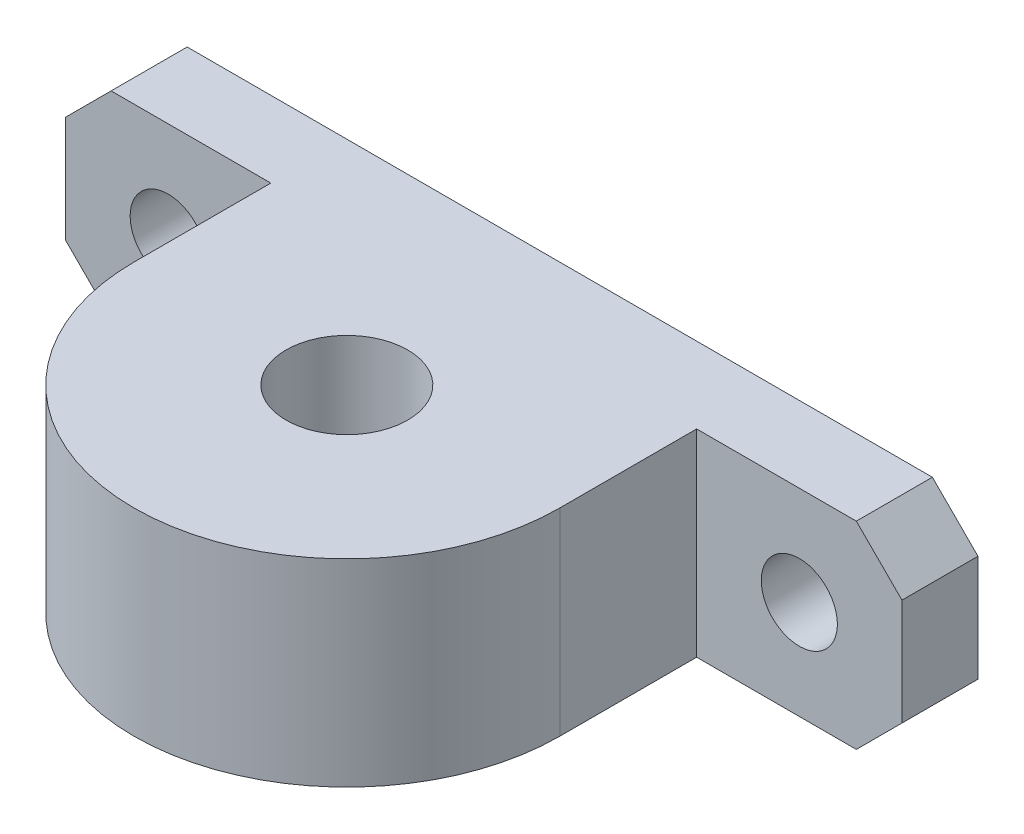
from build123d import *

# Parameters (mm, degrees)
SKETCH_1_R          = 4
EXTRUDE_1_DEPTH     = 13
CUT_EXTRUDE_1_REACH = 43.343
SKETCH_2_R          = 2.5
CHAMFER_1_SIZE      = 3


with BuildPart() as part:
    # 草图1 → 凸台-拉伸1 (new body)
    with BuildSketch(Plane(origin=(0, 0, 0), x_dir=(1, 0, 0), z_dir=(0, 1, 0))):
        with BuildLine():
            Line((-14, 0), (-14, 9))
            Line((-14, 9), (-27.5, 9))
            Line((-27.5, 9), (-27.5, 14))
            Line((-27.5, 14), (-14, 14))
            Line((-14, 14), (14, 14))
            Line((14, 14), (27.5, 14))
            Line((27.5, 14), (27.5, 9))
            Line((27.5, 9), (14, 9))
            Line((14, 9), (14, 0))
            ThreePointArc((14, 0), (9.899494937, -9.899494937), (0, -14))
            ThreePointArc((0, -14), (-9.899494937, -9.899494937), (-14, 0))
        make_face()
        with Locations(Location((0, 0, 0), (0, 0, 90))):
            Circle(SKETCH_1_R, mode=Mode.SUBTRACT)
    extrude(amount=EXTRUDE_1_DEPTH)

    # 草图2 → 切除-拉伸1 (cut, up to next)
    with BuildSketch(Plane(origin=(0, 0, -14), x_dir=(-1, 0, 0), z_dir=(0, 0, -1)), mode=Mode.PRIVATE) as cut_extrude_1_sk1:
        with Locations((-20.75, 6.5)):
            Circle(SKETCH_2_R)
    cut_extrude_1_tool1 = extrude(cut_extrude_1_sk1.sketch, amount=-CUT_EXTRUDE_1_REACH, mode=Mode.PRIVATE) & part.part
    # 草图2 → 切除-拉伸1 (cut, up to next)
    with BuildSketch(Plane(origin=(0, 0, -14), x_dir=(-1, 0, 0), z_dir=(0, 0, -1)), mode=Mode.PRIVATE) as cut_extrude_1_sk2:
        with Locations((20.75, 6.5)):
            Circle(SKETCH_2_R)
    cut_extrude_1_tool2 = extrude(cut_extrude_1_sk2.sketch, amount=-CUT_EXTRUDE_1_REACH, mode=Mode.PRIVATE) & part.part
    add(cut_extrude_1_tool1.solids().sort_by_distance((20.75, 6.5, -14))[0], mode=Mode.SUBTRACT)
    add(cut_extrude_1_tool2.solids().sort_by_distance((-20.75, 6.5, -14))[0], mode=Mode.SUBTRACT)

    # 倒角1
    chamfer_1_edges = [part.edges().sort_by_distance(p)[0] for p in [
        (-27.5, 0, -11.5),
        (27.5, 0, -11.5),
        (27.5, 13, -11.5),
        (-27.5, 13, -11.5),
    ]]
    chamfer(chamfer_1_edges, length=CHAMFER_1_SIZE)


solid = part.part
